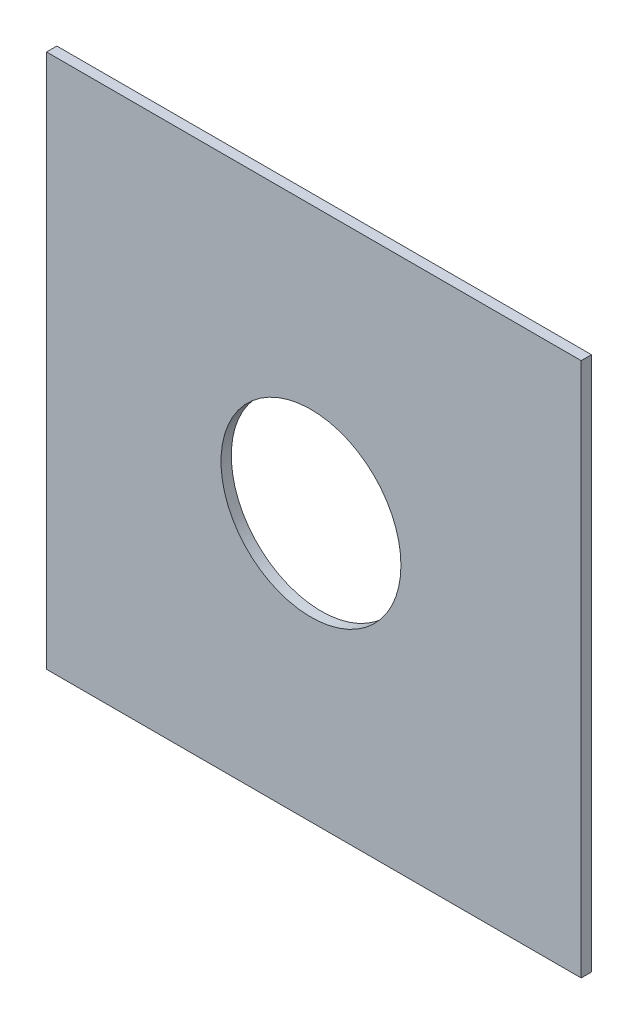
from build123d import *

# Parameters (mm, degrees)
SKETCH1_W           = 520
SKETCH1_H           = 520
SKETCH1_R           = 87.5
BOSS_EXTRUDE1_DEPTH = 10


with BuildPart() as part:
    # Sketch1 → Boss-Extrude1 (new body)
    with BuildSketch(Plane.XY):
        with Locations((2.814128303, 0)):
            Rectangle(SKETCH1_W, SKETCH1_H)
        Circle(SKETCH1_R, mode=Mode.SUBTRACT)
    extrude(amount=BOSS_EXTRUDE1_DEPTH)


solid = part.part
